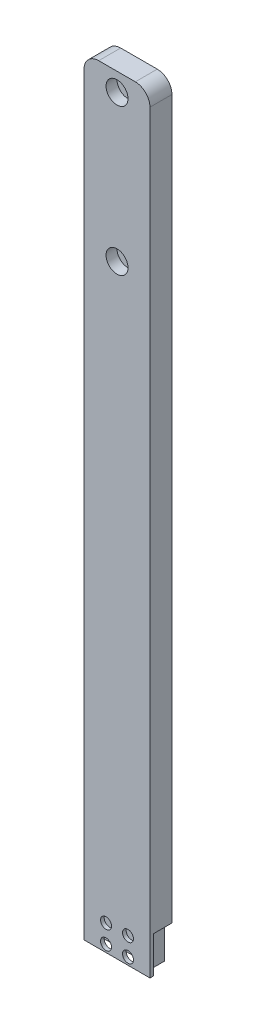
from build123d import *

# Parameters (mm, degrees)
SKETCH_1_W               = 18
SKETCH_1_H               = 200
SKETCH_1_R               = 3
EXTRUDE_1_DEPTH          = 6
SKETCH_2_W               = 14
SKETCH_2_H               = 3
EXTRUDE_2_DEPTH          = 10
SKETCH_5_W               = 18
SKETCH_5_H               = 10
EXTRUDE_4_DEPTH          = 1
CUT_EXTRUDE_2_DEPTH      = 153.826820813
CUT_EXTRUDE_2_DEPTH_BACK = 3
SKETCH_7_R               = 1.5
SKETCH_8_R               = 3
EXTRUDE_5_DEPTH          = 3
FILLET_1_R               = 4


with BuildPart() as part:
    # 草图1 → 凸台-拉伸1 (new body)
    with BuildSketch(Plane.XY):
        with Locations((-33.092307692, 46.830769231)):
            Rectangle(SKETCH_1_W, SKETCH_1_H)
        with Locations((-33.092307692, 141.830769231)):
            Circle(SKETCH_1_R, mode=Mode.SUBTRACT)
        with Locations((-33.092307692, 101.830769231)):
            Circle(SKETCH_1_R, mode=Mode.SUBTRACT)
    extrude(amount=EXTRUDE_1_DEPTH)

    # 草图2 → 凸台-拉伸2 (add)
    with BuildSketch(Plane.XZ.offset(53.169230769)):
        with Locations((-33.092307692, 1.5)):
            Rectangle(SKETCH_2_W, SKETCH_2_H)
    extrude(amount=EXTRUDE_2_DEPTH)

    # 草图5 → 凸台-拉伸4 (add)
    with BuildSketch(Plane.XY.offset(6)):
        with Locations((-33.092307692, -58.169230769)):
            Rectangle(SKETCH_5_W, SKETCH_5_H)
    extrude(amount=-EXTRUDE_4_DEPTH)

    # 草图7 → 切除-拉伸2 (cut, two sides: drawn at the far end of the back side and taken through both)
    with BuildSketch(Plane(origin=(0, 0, 5), x_dir=(-1, 0, 0), z_dir=(0, 0, -1)).offset(-CUT_EXTRUDE_2_DEPTH_BACK)):
        with Locations(Location((30.092307692, -56.169230769, 0), (0, 0, 180))):
            Circle(SKETCH_7_R)
        with Locations(Location((36.092307692, -56.169230769, 0), (0, 0, 180))):
            Circle(SKETCH_7_R)
        with Locations(Location((30.092307692, -61.169230769, 0), (0, 0, 180))):
            Circle(SKETCH_7_R)
        with Locations(Location((36.092307692, -61.169230769, 0), (0, 0, 180))):
            Circle(SKETCH_7_R)
    extrude(amount=CUT_EXTRUDE_2_DEPTH + CUT_EXTRUDE_2_DEPTH_BACK, mode=Mode.SUBTRACT)

    # 草图8 → 凸台-拉伸5 (add)
    with BuildSketch(Plane(origin=(0, 0, 0), x_dir=(-1, 0, 0), z_dir=(0, 0, -1))):
        with Locations((33.092307692, 141.830769231)):
            Circle(SKETCH_8_R)
        with Locations((33.092307692, 101.830769231)):
            Circle(SKETCH_8_R)
    extrude(amount=-EXTRUDE_5_DEPTH)

    # 圆角1
    fillet_1_edges = [part.edges().sort_by_distance(p)[0] for p in [
        (-42.092307692, 146.830769231, 3),
        (-24.092307692, 146.830769231, 3),
    ]]
    fillet(fillet_1_edges, radius=FILLET_1_R)


solid = part.part
